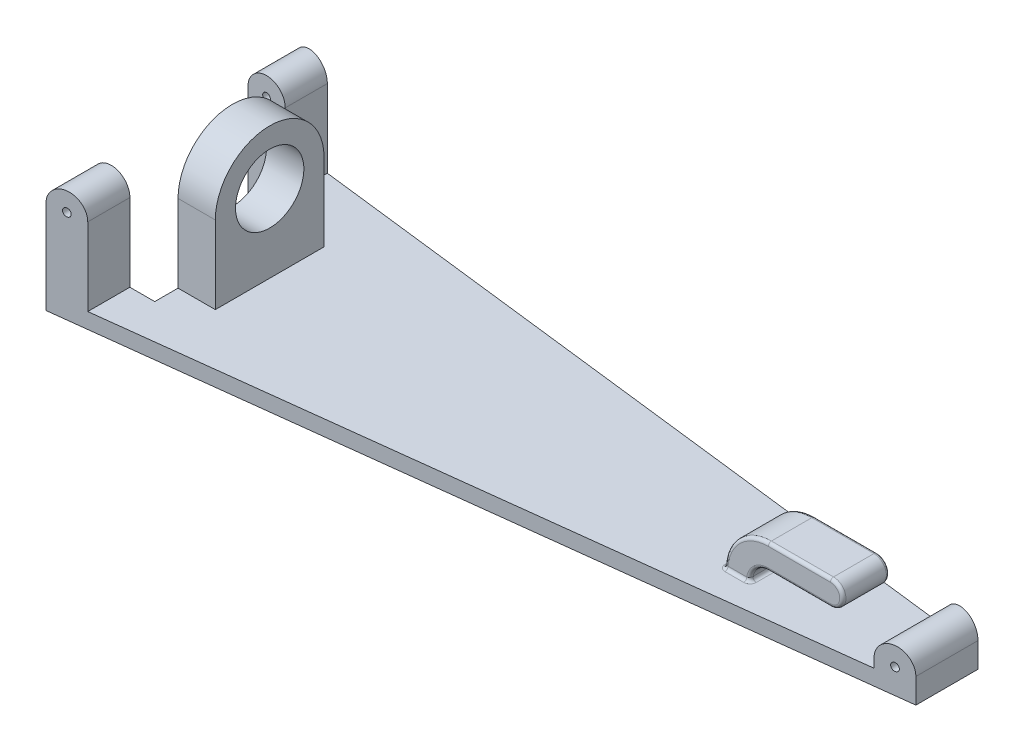
from build123d import *

# Parameters (mm, degrees)
BOSS_EXTRUDE1_DEPTH             = 5
BOSS_EXTRUDE2_REACH             = 255.229
SKETCH2_R                       = 1.25
BOSS_EXTRUDE2_DIRECTION_2_REACH = 255.229
CUT_EXTRUDE1_DEPTH              = 256.726416312
CUT_EXTRUDE1_DEPTH_BACK         = 256.726416312
SKETCH4_W                       = 20
SKETCH4_H                       = 50
SKETCH5_R                       = 11
BOSS_EXTRUDE3_DEPTH             = 12
BOSS_EXTRUDE4_DEPTH             = 7.5
FILLET1_R                       = 1


with BuildPart() as part:
    # Sketch1 → Boss-Extrude1 (new body)
    with BuildSketch(Plane(origin=(0, 0, 0), x_dir=(1, 0, 0), z_dir=(0, 1, 0))):
        Polygon((0, -40), (0, 40), (250, 10), (250, -10), align=None)
    extrude(amount=BOSS_EXTRUDE1_DEPTH)

    # Boss-Extrude2: up to this plane
    boss_extrude2_end = Plane(origin=(4.731861199, 5, 39.432176656), z_dir=(-0.11914522061843066, 0, -0.9928768384869221))
    # Sketch2 → Boss-Extrude2 (add, up to the surface)
    with BuildSketch(Plane.XY, mode=Mode.PRIVATE) as boss_extrude2_sk1:
        with BuildLine():
            Line((0, 30), (0, 5))
            Line((0, 5), (12, 5))
            Line((12, 5), (12, 30))
            ThreePointArc((12, 30), (6, 36), (0, 30))
        make_face()
        with Locations((6, 30)):
            Circle(SKETCH2_R, mode=Mode.SUBTRACT)
    boss_extrude2_tool1 = split(extrude(boss_extrude2_sk1.sketch, amount=BOSS_EXTRUDE2_REACH, mode=Mode.PRIVATE), bisect_by=boss_extrude2_end, keep=Keep.BOTH, mode=Mode.PRIVATE)
    add(boss_extrude2_tool1.solids().sort_by_distance((6, 19.745192, 0))[0])
    # Sketch2 → Boss-Extrude2 (add, up to the surface)
    with BuildSketch(Plane.XY, mode=Mode.PRIVATE) as boss_extrude2_sk2:
        with BuildLine():
            Line((238, 8), (238, 5))
            Line((238, 5), (250, 5))
            Line((250, 5), (250, 8))
            ThreePointArc((250, 8), (244, 14), (238, 8))
        make_face()
        with Locations((244, 8)):
            Circle(SKETCH2_R, mode=Mode.SUBTRACT)
    boss_extrude2_tool2 = split(extrude(boss_extrude2_sk2.sketch, amount=BOSS_EXTRUDE2_REACH, mode=Mode.PRIVATE), bisect_by=boss_extrude2_end, keep=Keep.BOTH, mode=Mode.PRIVATE)
    add(boss_extrude2_tool2.solids().sort_by_distance((244, 13.85, 0))[0])

    # Boss-Extrude2 direction 2: up to this plane
    boss_extrude2_direction_2_end = Plane(origin=(4.731861199, 5, -39.432176656), z_dir=(-0.11914522061843066, 0, 0.9928768384869221))
    # Sketch2 → Boss-Extrude2 direction 2 (add, up to the surface)
    with BuildSketch(Plane.XY, mode=Mode.PRIVATE) as boss_extrude2_direction_2_sk1:
        with BuildLine():
            Line((0, 30), (0, 5))
            Line((0, 5), (12, 5))
            Line((12, 5), (12, 30))
            ThreePointArc((12, 30), (6, 36), (0, 30))
        make_face()
        with Locations((6, 30)):
            Circle(SKETCH2_R, mode=Mode.SUBTRACT)
    boss_extrude2_direction_2_tool1 = split(extrude(boss_extrude2_direction_2_sk1.sketch, amount=-BOSS_EXTRUDE2_DIRECTION_2_REACH, mode=Mode.PRIVATE), bisect_by=boss_extrude2_direction_2_end, keep=Keep.BOTH, mode=Mode.PRIVATE)
    add(boss_extrude2_direction_2_tool1.solids().sort_by_distance((6, 19.745192, 0))[0])
    # Sketch2 → Boss-Extrude2 direction 2 (add, up to the surface)
    with BuildSketch(Plane.XY, mode=Mode.PRIVATE) as boss_extrude2_direction_2_sk2:
        with BuildLine():
            Line((238, 8), (238, 5))
            Line((238, 5), (250, 5))
            Line((250, 5), (250, 8))
            ThreePointArc((250, 8), (244, 14), (238, 8))
        make_face()
        with Locations((244, 8)):
            Circle(SKETCH2_R, mode=Mode.SUBTRACT)
    boss_extrude2_direction_2_tool2 = split(extrude(boss_extrude2_direction_2_sk2.sketch, amount=-BOSS_EXTRUDE2_DIRECTION_2_REACH, mode=Mode.PRIVATE), bisect_by=boss_extrude2_direction_2_end, keep=Keep.BOTH, mode=Mode.PRIVATE)
    add(boss_extrude2_direction_2_tool2.solids().sort_by_distance((244, 13.85, 0))[0])

    # Sketch4 → Cut-Extrude1 (cut, two sides: drawn at the far end of the back side and taken through both)
    with BuildSketch(Plane(origin=(0, 0, 0), x_dir=(1, 0, 0), z_dir=(0, 1, 0)).offset(-CUT_EXTRUDE1_DEPTH_BACK)):
        with Locations((10, 0)):
            Rectangle(SKETCH4_W, SKETCH4_H)
    extrude(amount=CUT_EXTRUDE1_DEPTH + CUT_EXTRUDE1_DEPTH_BACK, mode=Mode.SUBTRACT)

    # Sketch5 → Boss-Extrude3 (add)
    with BuildSketch(Plane.ZY.offset(-20)):
        with BuildLine():
            Line((-17.5, 30), (-17.5, 5))
            Line((-17.5, 5), (17.5, 5))
            Line((17.5, 5), (17.5, 30))
            ThreePointArc((17.5, 30), (0, 47.5), (-17.5, 30))
        make_face()
        with Locations((0, 30)):
            Circle(SKETCH5_R, mode=Mode.SUBTRACT)
    extrude(amount=-BOSS_EXTRUDE3_DEPTH)

    # Sketch6 → Boss-Extrude4 (add, symmetric)
    with BuildSketch(Plane.XY):
        with BuildLine():
            Line((200, 11), (220, 11))
            ThreePointArc((220, 11), (224, 15), (220, 19))
            Line((220, 19), (200, 19))
            ThreePointArc((200, 19), (190.100505063, 14.899494937), (186, 5))
            Line((186, 5), (194, 5))
            ThreePointArc((194, 5), (195.757359313, 9.242640687), (200, 11))
        make_face()
    extrude(amount=BOSS_EXTRUDE4_DEPTH, both=True)

    # Fillet1
    fillet1_edges = [part.edges().sort_by_distance(p)[0] for p in [
        (224, 15, -7.5),
        (210, 19, -7.5),
        (190.100505063, 14.899494937, -7.5),
        (190, 5, -7.5),
        (186, 5, 0),
        (195.757359313, 9.242640687, -7.5),
        (194, 5, 0),
        (210, 11, -7.5),
        (224, 15, 7.5),
        (210, 19, 7.5),
        (190.100505063, 14.899494937, 7.5),
        (190, 5, 7.5),
        (195.757359313, 9.242640687, 7.5),
        (210, 11, 7.5),
    ]]
    fillet(fillet1_edges, radius=FILLET1_R)


solid = part.part
